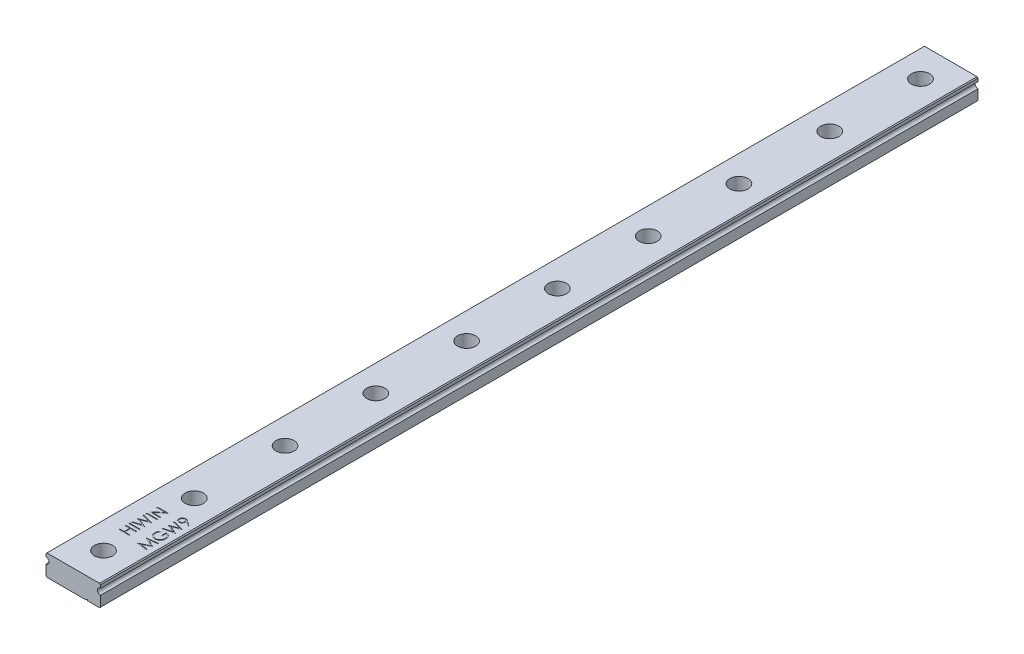
from build123d import *

# Parameters (mm, degrees)
EXTRUDE_1_DEPTH              = 290
HOLE_WIZARD_M3_1_D           = 3.5
HOLE_WIZARD_M3_1_CBORE_D     = 6
HOLE_WIZARD_M3_1_CBORE_DEPTH = 4.5
PATTERN_LINEAR_1_COUNT       = 10
PATTERN_LINEAR_1_PITCH       = 30
SKETCH_4_W                   = 3.5
SKETCH_4_H                   = 0.314102564
CUT_EXTRUDE_1_DEPTH          = 0.1


with BuildPart() as part:
    # 草图1 → 凸台-拉伸1 (new body)
    with BuildSketch(Plane.XY):
        with BuildLine():
            Line((9, 5.7), (9, 6.7))
            Line((9, 6.7), (8.7, 7))
            Line((8.7, 7), (-8.7, 7))
            Line((-8.7, 7), (-9, 6.7))
            Line((-9, 6.7), (-9, 5.7))
            ThreePointArc((-9, 5.7), (-8, 4.7), (-9, 3.7))
            Line((-9, 3.7), (-9, 0.3))
            Line((-9, 0.3), (-8.7, 0))
            Line((-8.7, 0), (4.2, 0))
            ThreePointArc((4.2, 0), (4.5, 0.3), (4.8, 0))
            Line((4.8, 0), (8.7, 0))
            Line((8.7, 0), (9, 0.3))
            Line((9, 0.3), (9, 3.7))
            ThreePointArc((9, 3.7), (8, 4.7), (9, 5.7))
        make_face()
    extrude(amount=-EXTRUDE_1_DEPTH)

    # M3 六角凹头螺钉的柱形沉头孔1 (through all)
    with Locations(Plane(origin=(-0.084506888, 7, -67.993710711), x_dir=(-1, 0, 0), z_dir=(0, 1, 0))):
        with Locations((-0.084506888, 57.993710711)):
            hole_wizard_m3_1 = CounterBoreHole(HOLE_WIZARD_M3_1_D / 2, HOLE_WIZARD_M3_1_CBORE_D / 2, HOLE_WIZARD_M3_1_CBORE_DEPTH)

    # 阵列(线性)1: M3 六角凹头螺钉的柱形沉头孔1 ×10
    with Locations(*[(0, 0, -i * PATTERN_LINEAR_1_PITCH) for i in range(1, PATTERN_LINEAR_1_COUNT)]):
        add(hole_wizard_m3_1, mode=Mode.SUBTRACT)

    # 草图4 → 切除-拉伸1 (cut)
    # profile 1 of 9: a face of its own
    with BuildSketch(Plane(origin=(0, 7, 0), x_dir=(1, 0, 0), z_dir=(0, 1, 0))):
        Polygon((-3.5, 18.538461538), (-3.5, 18.852564103), (-2.064102564, 18.852564103), (-2.064102564, 20.647435897), (-3.5, 20.647435897), (-3.5, 20.961538462), (0, 20.961538462), (0, 20.647435897), (-1.705128205, 20.647435897), (-1.705128205, 18.852564103), (0, 18.852564103), (0, 18.538461538), align=None)
    # profile 2 of 9: a face of its own
    with BuildSketch(Plane(origin=(0, 7, 0), x_dir=(1, 0, 0), z_dir=(0, 1, 0))):
        with Locations((-1.75, 22.016025641)):
            Rectangle(SKETCH_4_W, SKETCH_4_H)
    # profile 3 of 9: a face of its own
    with BuildSketch(Plane(origin=(0, 7, 0), x_dir=(1, 0, 0), z_dir=(0, 1, 0))):
        Polygon((-3.5, 22.711538462), (-3.5, 23.036157853), (-0.933193109, 23.721153846), (-3.5, 24.739883814), (-3.5, 24.785456731), (-0.950721154, 25.78525641), (-3.5, 26.473758013), (-3.5, 26.794871795), (0, 25.851161859), (0, 25.806290064), (-2.676883013, 24.753205128), (0, 23.6875), (0, 23.642628205), align=None)
    # profile 4 of 9: a face of its own
    with BuildSketch(Plane(origin=(0, 7, 0), x_dir=(1, 0, 0), z_dir=(0, 1, 0))):
        with Locations((-1.75, 27.759615385)):
            Rectangle(SKETCH_4_W, SKETCH_4_H)
    # profile 5 of 9: a face of its own
    with BuildSketch(Plane(origin=(0, 7, 0), x_dir=(1, 0, 0), z_dir=(0, 1, 0))):
        Polygon((0, 28.679487179), (-3.5, 28.679487179), (-3.5, 28.745392628), (-0.745292468, 31.057692308), (-3.5, 31.057692308), (-3.5, 31.371794872), (0, 31.371794872), (0, 31.300280449), (-2.748397436, 28.993589744), (0, 28.993589744), align=None)
    # profile 6 of 9: a face of its own
    with BuildSketch(Plane(origin=(0, 7, 0), x_dir=(1, 0, 0), z_dir=(0, 1, 0))):
        Polygon((6.967948718, 17.259615385), (3.467948718, 17.721654647), (3.467948718, 17.766526442), (6.33974359, 19.211538462), (3.467948718, 20.653044872), (3.467948718, 20.698617788), (6.967948718, 21.163461538), (6.967948718, 20.847956731), (4.449519231, 20.512820513), (6.967948718, 19.249399038), (6.967948718, 19.178585737), (4.443910256, 17.91025641), (6.967948718, 17.575821314), align=None)
    # profile 7 of 9: a face of its own
    with BuildSketch(Plane(origin=(0, 7, 0), x_dir=(1, 0, 0), z_dir=(0, 1, 0))):
        with BuildLine():
            Line((4.065304487, 25.157051282), (4.320512821, 24.887820513))
            add(Edge.make_bspline(
                [(4.320512821, 24.887820513), (4.274666598, 24.839111432), (4.184067383, 24.742854768), (4.066704644, 24.585654825), (3.965171715, 24.422298972), (3.883176125, 24.252523072), (3.818854464, 24.080779072), (3.7720985, 23.910020119), (3.742488341, 23.74135182), (3.738931922, 23.629187518), (3.737179487, 23.573918269)],
                knots=[0, 0, 0, 0, 1.089067066, 2.152164705, 3.18986567, 4.218445106, 5.218487318, 6.173592265, 7.100032889, 8, 8, 8, 8], degree=3))
            add(Edge.make_bspline(
                [(3.737179487, 23.573918269), (3.737593093, 23.540003569), (3.738419232, 23.472262129), (3.748963447, 23.371640185), (3.764128311, 23.272073548), (3.786070189, 23.173750173), (3.813879248, 23.076478886), (3.848664714, 22.980597998), (3.889219947, 22.885928627), (3.936082466, 22.793362608), (3.987562143, 22.703621874), (4.044611304, 22.618865878), (4.105397829, 22.538549416), (4.171457105, 22.464200209), (4.242141407, 22.395323695), (4.316177774, 22.330652995), (4.395021846, 22.271393416), (4.478349397, 22.218607776), (4.56422185, 22.170940182), (4.651910923, 22.129747982), (4.740602575, 22.093938028), (4.83096464, 22.066664067), (4.922065521, 22.043563193), (5.014382632, 22.027481957), (5.108157049, 22.01838564), (5.170954747, 22.016815149), (5.202524038, 22.016025641)],
                knots=[0, 0, 0, 0, 1.028150113, 2.053633673, 3.06513288, 4.081487945, 5.106702018, 6.131327874, 7.172780699, 8.228344599, 9.276313556, 10.308389736, 11.324843658, 12.329040066, 13.321460474, 14.316307835, 15.308626991, 16.309440696, 17.305625405, 18.28535951, 19.246194545, 20.203493668, 21.145557131, 22.095268976, 23.042464743, 24, 24, 24, 24], degree=3))
            add(Edge.make_bspline(
                [(5.202524038, 22.016025641), (5.2347947, 22.016781836), (5.299247902, 22.018292162), (5.395444304, 22.027945359), (5.490200886, 22.045900569), (5.583666689, 22.069712319), (5.676027725, 22.099984994), (5.767187608, 22.137177508), (5.857137476, 22.181483641), (5.944984394, 22.232654909), (6.030484526, 22.289164377), (6.111697005, 22.351315561), (6.187676723, 22.419213098), (6.259533466, 22.491612041), (6.326813744, 22.569172037), (6.388706596, 22.652645569), (6.446169075, 22.740864161), (6.498569911, 22.83386695), (6.545377278, 22.93067093), (6.587001488, 23.029927361), (6.621280742, 23.131955263), (6.649218868, 23.23621793), (6.672119159, 23.342591208), (6.686851641, 23.451615009), (6.697542472, 23.562487717), (6.698324142, 23.637226349), (6.698717949, 23.674879808)],
                knots=[0, 0, 0, 0, 0.935915162, 1.869274651, 2.799799983, 3.730201895, 4.664668062, 5.616159355, 6.583070886, 7.570012957, 8.562524459, 9.553461134, 10.53281078, 11.515274572, 12.509912756, 13.507571325, 14.526460018, 15.561318395, 16.601025881, 17.643204557, 18.680545676, 19.719612342, 20.772381578, 21.833430283, 22.908478249, 24, 24, 24, 24], degree=3))
            add(Edge.make_bspline(
                [(6.698717949, 23.674879808), (6.697769766, 23.72025834), (6.695907855, 23.80936646), (6.681401983, 23.94035028), (6.658775513, 24.066162898), (6.625536462, 24.186394736), (6.583464013, 24.301482131), (6.531435433, 24.411000619), (6.469998149, 24.515252613), (6.400396255, 24.613786873), (6.322847788, 24.704260894), (6.239913081, 24.786602973), (6.15051765, 24.857981595), (6.0559938, 24.920528912), (5.955437392, 24.972226156), (5.84940783, 25.014672034), (5.737839505, 25.047204491), (5.660747985, 25.060559579), (5.621794872, 25.067307692)],
                knots=[0, 0, 0, 0, 1.130199668, 2.219330667, 3.279027493, 4.311506524, 5.322739849, 6.327972234, 7.327472899, 8.33386792, 9.329086447, 10.29244429, 11.240784345, 12.174119183, 13.111530729, 14.052100829, 15.015757696, 16, 16, 16, 16], degree=3))
            Line((5.621794872, 25.067307692), (5.621794872, 23.900641026))
            Line((5.621794872, 23.900641026), (5.262820513, 23.900641026))
            Line((5.262820513, 23.900641026), (5.262820513, 25.381410256))
            add(Edge.make_bspline(
                [(5.262820513, 25.381410256), (5.329728002, 25.379704408), (5.460678043, 25.376365755), (5.651648314, 25.352946839), (5.832020008, 25.315130327), (6.001983079, 25.263470015), (6.161296672, 25.196594735), (6.310122538, 25.115222206), (6.447499219, 25.018050085), (6.574548223, 24.908539644), (6.687877435, 24.785639686), (6.787483373, 24.652671066), (6.871385988, 24.509414097), (6.93964665, 24.35600429), (6.992920645, 24.192943856), (7.030692222, 24.019855477), (7.053322185, 23.836973876), (7.056213565, 23.711637199), (7.057692308, 23.647536058)],
                knots=[0, 0, 0, 0, 1.140356446, 2.231883559, 3.274166699, 4.278491846, 5.25512956, 6.21435461, 7.1637429, 8.11826594, 9.068280886, 10.0076534, 10.945064095, 11.891975133, 12.864533718, 13.863980011, 14.907571808, 16, 16, 16, 16], degree=3))
            add(Edge.make_bspline(
                [(7.057692308, 23.647536058), (7.057123186, 23.608025922), (7.056000696, 23.530099201), (7.048023349, 23.415008273), (7.035742772, 23.303090653), (7.017197649, 23.194362644), (6.994482995, 23.088424302), (6.965396276, 22.985804717), (6.931727576, 22.886112975), (6.893431903, 22.789194989), (6.849060246, 22.695930442), (6.799750607, 22.605903925), (6.745757246, 22.5186178), (6.6861464, 22.434666635), (6.62136394, 22.353613013), (6.551280021, 22.27597957), (6.476108901, 22.201331692), (6.422729892, 22.154571228), (6.395833333, 22.131009615)],
                knots=[0, 0, 0, 0, 1.107784379, 2.184907829, 3.233506516, 4.263428166, 5.276301166, 6.270063455, 7.25232949, 8.225834625, 9.190232166, 10.146266622, 11.1027726, 12.066435141, 13.031522626, 14.010570082, 14.99756817, 16, 16, 16, 16], degree=3))
            add(Edge.make_bspline(
                [(6.395833333, 22.131009615), (6.35316268, 22.096823683), (6.268529663, 22.029019271), (6.132929719, 21.941741114), (5.992527859, 21.867339711), (5.84693323, 21.806971889), (5.696282017, 21.759833803), (5.540766726, 21.72602755), (5.380187096, 21.706220261), (5.271521831, 21.703366724), (5.216546474, 21.701923077)],
                knots=[0, 0, 0, 0, 1.023165419, 2.029347347, 3.013907458, 3.994755782, 4.975994455, 5.96558838, 6.970761222, 8, 8, 8, 8], degree=3))
            add(Edge.make_bspline(
                [(5.216546474, 21.701923077), (5.175380222, 21.702455315), (5.093570914, 21.703513027), (4.972113608, 21.716338544), (4.85281291, 21.734739957), (4.735766374, 21.761787032), (4.620895706, 21.795883218), (4.508148028, 21.838436999), (4.397455075, 21.887980777), (4.289585288, 21.945570494), (4.185945674, 22.009639231), (4.087043404, 22.079246887), (3.994481386, 22.154930572), (3.908045197, 22.236910667), (3.826453743, 22.323534597), (3.751411343, 22.416620898), (3.681743707, 22.514759234), (3.618789497, 22.618710374), (3.562221643, 22.726834005), (3.512633564, 22.838895091), (3.471649942, 22.954852909), (3.436876246, 23.073840466), (3.411161083, 23.196757945), (3.392512344, 23.322713488), (3.379751742, 23.452363598), (3.378725487, 23.539999628), (3.378205128, 23.584435096)],
                knots=[0, 0, 0, 0, 1.00895651, 2.005089799, 2.991467152, 3.967318338, 4.948153826, 5.927364234, 6.919980553, 7.91976625, 8.923240147, 9.905815003, 10.88314567, 11.851989312, 12.825009789, 13.798721852, 14.781296708, 15.773896486, 16.776076962, 17.771600213, 18.775744723, 19.78957137, 20.808953803, 21.851964491, 22.910847925, 24, 24, 24, 24], degree=3))
            add(Edge.make_bspline(
                [(3.378205128, 23.584435096), (3.37878462, 23.62067334), (3.379933684, 23.692529519), (3.387898332, 23.799455251), (3.400522213, 23.904728266), (3.417749, 24.008504655), (3.44121269, 24.110431022), (3.469290975, 24.210797727), (3.501982797, 24.309750263), (3.540971644, 24.406978512), (3.585225269, 24.503136228), (3.635038691, 24.598758069), (3.691263696, 24.693517315), (3.754067231, 24.787578296), (3.822370649, 24.881534154), (3.898127473, 24.973898797), (3.978350229, 25.066901741), (4.036032413, 25.126703555), (4.065304487, 25.157051282)],
                knots=[0, 0, 0, 0, 0.985871117, 1.954866573, 2.915460327, 3.869826059, 4.81536089, 5.759505086, 6.70452669, 7.649098992, 8.607881297, 9.583363685, 10.581137262, 11.603961102, 12.659522466, 13.73993555, 14.853081303, 16, 16, 16, 16], degree=3))
        make_face()
    # profile 8 of 9: a face of its own
    with BuildSketch(Plane(origin=(0, 7, 0), x_dir=(1, 0, 0), z_dir=(0, 1, 0))):
        Polygon((3.467948718, 25.875), (3.467948718, 26.199619391), (6.034755609, 26.884615385), (3.467948718, 27.903345353), (3.467948718, 27.948918269), (6.017227564, 28.948717949), (3.467948718, 29.637219551), (3.467948718, 29.958333333), (6.967948718, 29.014623397), (6.967948718, 28.969751603), (4.291065705, 27.916666667), (6.967948718, 26.850961538), (6.967948718, 26.806089744), align=None)
    # profile 9 of 9: a face of its own
    with BuildSketch(Plane(origin=(0, 7, 0), x_dir=(1, 0, 0), z_dir=(0, 1, 0))):
        with BuildLine():
            Line((7.057692308, 31.21474359), (6.883112981, 30.963741987))
            Line((6.883112981, 30.963741987), (5.460536859, 31.936899038))
            add(Edge.make_bspline(
                [(5.460536859, 31.936899038), (5.468484228, 31.874816887), (5.484128885, 31.752606126), (5.486173514, 31.629419057), (5.487179487, 31.568810096)],
                knots=[0, 0, 0, 0, 1.015985029, 2, 2, 2, 2], degree=3))
            add(Edge.make_bspline(
                [(5.487179487, 31.568810096), (5.486238411, 31.532068048), (5.48439116, 31.459946622), (5.469749352, 31.353914968), (5.447199222, 31.252029412), (5.413550474, 31.154560041), (5.371732239, 31.061140592), (5.319875323, 30.971974669), (5.258868658, 30.887183581), (5.189037089, 30.807673113), (5.112353766, 30.735372706), (5.031217129, 30.670908546), (4.944751315, 30.617625601), (4.854779905, 30.572573239), (4.759382554, 30.539364355), (4.660177979, 30.514597119), (4.556550375, 30.499515979), (4.486027439, 30.497711216), (4.450220353, 30.496794872)],
                knots=[0, 0, 0, 0, 1.060698949, 2.082059282, 3.085738422, 4.069684654, 5.054463875, 6.037298355, 7.043153692, 8.066652628, 9.088369706, 10.083456696, 11.053578809, 12.016466116, 12.983507685, 13.964045196, 14.966270913, 16, 16, 16, 16], degree=3))
            add(Edge.make_bspline(
                [(4.450220353, 30.496794872), (4.401253588, 30.498532793), (4.305141762, 30.501943978), (4.164681125, 30.529292887), (4.031796079, 30.57460498), (3.906635217, 30.636793474), (3.792073486, 30.716623684), (3.688499026, 30.811427974), (3.597759456, 30.921972578), (3.519848855, 31.04537136), (3.456761609, 31.178548236), (3.411940809, 31.31860434), (3.383308236, 31.463180339), (3.3799135, 31.561432729), (3.378205128, 31.610877404)],
                knots=[0, 0, 0, 0, 1.023011052, 2.007963168, 2.978169221, 3.950402619, 4.919353283, 5.887490769, 6.876420893, 7.899700203, 8.931203047, 9.947778163, 10.96723692, 12, 12, 12, 12], degree=3))
            add(Edge.make_bspline(
                [(3.378205128, 31.610877404), (3.380035301, 31.659365807), (3.383651551, 31.755174323), (3.410135375, 31.896063561), (3.454772592, 32.031003704), (3.516455108, 32.159251982), (3.593783616, 32.277979178), (3.685890325, 32.3847997), (3.792852151, 32.476878922), (3.911730876, 32.555383638), (4.040246296, 32.617227218), (4.174138011, 32.66254286), (4.312600654, 32.690242692), (4.406391902, 32.693745196), (4.453725962, 32.695512821)],
                knots=[0, 0, 0, 0, 1.026358223, 2.027987109, 3.023239252, 4.028077889, 5.032770297, 6.015020143, 7.004250571, 8.011656937, 9.02310243, 10.015224881, 10.998334443, 12, 12, 12, 12], degree=3))
            add(Edge.make_bspline(
                [(4.453725962, 32.695512821), (4.490468378, 32.694329163), (4.564991178, 32.69192841), (4.678017661, 32.675308171), (4.793168632, 32.646639359), (4.890727756, 32.614605929), (4.971550238, 32.583207772), (5.035581535, 32.554505227), (5.102509069, 32.521163256), (5.172606902, 32.483926368), (5.245966492, 32.442865108), (5.322079032, 32.396863244), (5.401055492, 32.346541246), (5.454303784, 32.310713843), (5.481570513, 32.292367788)],
                knots=[0, 0, 0, 0, 1.179894106, 2.393120058, 3.660107319, 4.986885617, 5.687958251, 6.443931318, 7.239444731, 8.088894906, 8.992865148, 9.938946712, 10.944601238, 12, 12, 12, 12], degree=3))
            Line((5.481570513, 32.292367788), (7.057692308, 31.21474359))
        make_face()
        with BuildLine():
            add(Edge.make_bspline(
                [(5.128205128, 31.627003205), (5.127443169, 31.654836551), (5.125959894, 31.709018613), (5.116972501, 31.788405182), (5.10091985, 31.86329601), (5.078251267, 31.934173102), (5.049534697, 32.000950651), (5.014538857, 32.063649693), (4.97249706, 32.121629784), (4.925241239, 32.175097344), (4.873450736, 32.223620781), (4.817962021, 32.265459166), (4.760498938, 32.301683637), (4.699885133, 32.330582666), (4.637112179, 32.353872325), (4.571272257, 32.370123036), (4.502819953, 32.379098526), (4.456321832, 32.380631318), (4.432692308, 32.381410256)],
                knots=[0, 0, 0, 0, 1.163726718, 2.265380301, 3.334713825, 4.36057981, 5.371541381, 6.368955992, 7.355979581, 8.359691305, 9.348261197, 10.317521986, 11.261029684, 12.183096459, 13.119698615, 14.055740009, 15.011961376, 16, 16, 16, 16], degree=3))
            add(Edge.make_bspline(
                [(4.432692308, 32.381410256), (4.409052319, 32.380741236), (4.362466821, 32.37942285), (4.293921732, 32.368826223), (4.228211162, 32.350235718), (4.164887772, 32.325039313), (4.104297734, 32.292476775), (4.04625008, 32.253022786), (3.991623454, 32.205381257), (3.939517566, 32.152143972), (3.892248709, 32.093589326), (3.850485484, 32.031550316), (3.815239605, 31.966358363), (3.787407408, 31.897722647), (3.764606292, 31.82657522), (3.748465177, 31.752179536), (3.739472619, 31.674432778), (3.7379536, 31.621650296), (3.737179487, 31.594751603)],
                knots=[0, 0, 0, 0, 0.971910406, 1.91526867, 2.84337505, 3.775008003, 4.712374136, 5.666733183, 6.654995996, 7.688089235, 8.726800303, 9.745078658, 10.75990398, 11.768337501, 12.786615857, 13.829099629, 14.893678693, 16, 16, 16, 16], degree=3))
            add(Edge.make_bspline(
                [(3.737179487, 31.594751603), (3.737954872, 31.568086848), (3.739476172, 31.515770819), (3.748447901, 31.438715191), (3.764715942, 31.364822663), (3.787397076, 31.293881759), (3.815241735, 31.225248032), (3.850487343, 31.160059153), (3.892239015, 31.09800569), (3.939555202, 31.039506747), (3.99138048, 30.986173509), (4.046494174, 30.939338145), (4.104267004, 30.899794933), (4.164895888, 30.867277883), (4.228209004, 30.842069447), (4.293922316, 30.823482154), (4.362466669, 30.812884664), (4.409052268, 30.811566396), (4.432692308, 30.810897436)],
                knots=[0, 0, 0, 0, 1.099107991, 2.156440826, 3.191784126, 4.212280276, 5.222910149, 6.239945746, 7.260441896, 8.30141526, 9.33675856, 10.320924759, 11.277362386, 12.216770088, 13.150432123, 14.080559904, 15.025972789, 16, 16, 16, 16], degree=3))
            add(Edge.make_bspline(
                [(4.432692308, 30.810897436), (4.456340163, 30.81150402), (4.502978061, 30.812700315), (4.571509405, 30.824218625), (4.637179138, 30.843532257), (4.700547843, 30.869142235), (4.760795693, 30.903511564), (4.818235099, 30.945280238), (4.874040333, 30.993474159), (4.925079304, 31.049672747), (4.972723236, 31.110020312), (5.014274516, 31.174840024), (5.04911654, 31.242829298), (5.078335917, 31.313551594), (5.100691189, 31.387536106), (5.116942683, 31.464679812), (5.125873731, 31.544996604), (5.12742054, 31.599405412), (5.128205128, 31.627003205)],
                knots=[0, 0, 0, 0, 0.952872936, 1.879239831, 2.791748947, 3.708674669, 4.628500839, 5.580394867, 6.568761142, 7.595635223, 8.636123962, 9.665976811, 10.694276597, 11.712685318, 12.747011694, 13.805940053, 14.887106426, 16, 16, 16, 16], degree=3))
        make_face(mode=Mode.SUBTRACT)
    extrude(amount=-CUT_EXTRUDE_1_DEPTH, mode=Mode.SUBTRACT)


solid = part.part
